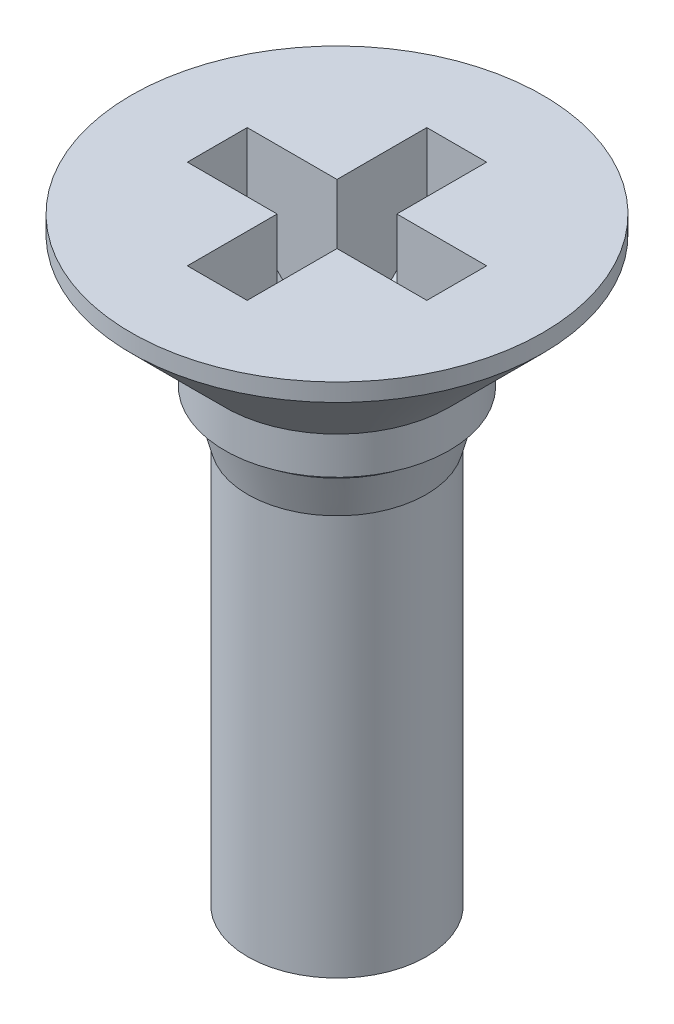
from build123d import *

# Parameters (mm, degrees)
KREUZSCHLITZ1_H_DEPTH      = 0.4
KREUZSCHLITZ1_H_DEPTH_BACK = 0.4
KREUZSCHLITZ2_H_DEPTH      = 0.4
KREUZSCHLITZ2_H_DEPTH_BACK = 0.4


with BuildPart() as part:
    # Skizze1 → Basis-Rotation (revolve)
    with BuildSketch(Plane.XY, mode=Mode.PRIVATE) as basis_rotation_sk:
        Polygon((0, 0), (2.75, 0), (2.75, -0.2375), (1.5, -1.4875), (1.5, -1.9875), (1.3375, -1.9875), (1.3375, -2.112584684), (1.1935, -2.65), (1.1935, -8), (0, -8), align=None)
    revolve(basis_rotation_sk.sketch.rotate(Axis((0, 0, 0), (0, -1, 0)), 180), axis=Axis((0, 0, 0), (0, -1, 0)))

    # Skizze2 → Kreuzschlitz1 H (cut, two sides: drawn at the far end of the back side and taken through both)
    with BuildSketch(Plane.XY.offset(-KREUZSCHLITZ1_H_DEPTH_BACK)):
        Polygon((-0.55, -2.1), (0.55, -2.1), (1.6, -1.05), (1.6, 0), (-1.6, 0), (-1.6, -1.05), align=None)
    extrude(amount=KREUZSCHLITZ1_H_DEPTH + KREUZSCHLITZ1_H_DEPTH_BACK, mode=Mode.SUBTRACT)

    # Skizze3 → Kreuzschlitz2 H (cut, two sides: drawn at the far end of the back side and taken through both)
    with BuildSketch(Plane(origin=(0, 0, 0), x_dir=(0, 0, -1), z_dir=(1, 0, 0)).offset(-KREUZSCHLITZ2_H_DEPTH_BACK)):
        Polygon((-0.55, -2.1), (0.55, -2.1), (1.6, -1.05), (1.6, 0), (-1.6, 0), (-1.6, -1.05), align=None)
    extrude(amount=KREUZSCHLITZ2_H_DEPTH + KREUZSCHLITZ2_H_DEPTH_BACK, mode=Mode.SUBTRACT)


solid = part.part
